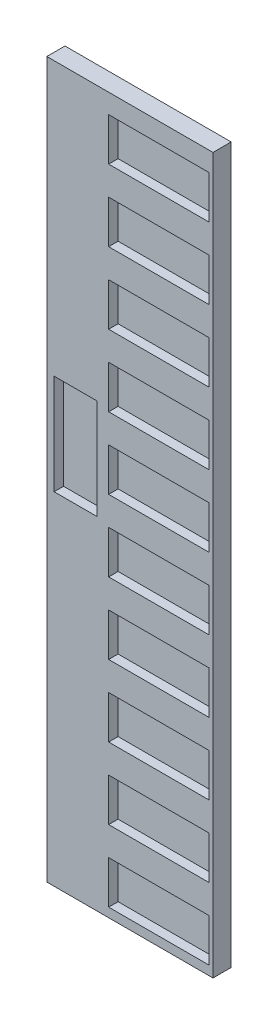
from build123d import *

# Parameters (mm, degrees)
SKETCH1_W           = 76.2
SKETCH1_H           = 500
BOSS_EXTRUDE2_DEPTH = 12.7
SKETCH3_W           = 70
SKETCH3_H           = 30
CUT_EXTRUDE4_DEPTH  = 6.604
LPATTERN1_COUNT     = 10
LPATTERN1_PITCH     = 50
SKETCH4_W           = 12.7
SKETCH4_H           = 500
BOSS_EXTRUDE4_DEPTH = 40
SKETCH5_W           = 30
SKETCH5_H           = 70
CUT_EXTRUDE5_DEPTH  = 6.604


with BuildPart() as part:
    # Sketch1 → Boss-Extrude2 (new body)
    with BuildSketch(Plane.XY):
        Rectangle(SKETCH1_W, SKETCH1_H)
    extrude(amount=BOSS_EXTRUDE2_DEPTH)

    # Sketch3 → Cut-Extrude4 (cut)
    with BuildSketch(Plane.XY.offset(12.7)):
        with Locations((0.129688718, 221.422286077)):
            Rectangle(SKETCH3_W, SKETCH3_H)
    cut_extrude4 = extrude(amount=-CUT_EXTRUDE4_DEPTH, mode=Mode.SUBTRACT)

    # LPattern1: Cut-Extrude4 ×10
    with Locations(*[(0, -i * LPATTERN1_PITCH, 0) for i in range(1, LPATTERN1_COUNT)]):
        add(cut_extrude4, mode=Mode.SUBTRACT)

    # Sketch4 → Boss-Extrude4 (add)
    with BuildSketch(Plane.ZY.offset(38.1)):
        with Locations((6.35, 0)):
            Rectangle(SKETCH4_W, SKETCH4_H)
    extrude(amount=BOSS_EXTRUDE4_DEPTH)

    # Sketch5 → Cut-Extrude5 (cut)
    with BuildSketch(Plane.XY.offset(12.7)):
        with Locations((-58.010071461, 23.936214581)):
            Rectangle(SKETCH5_W, SKETCH5_H)
    extrude(amount=-CUT_EXTRUDE5_DEPTH, mode=Mode.SUBTRACT)


solid = part.part
